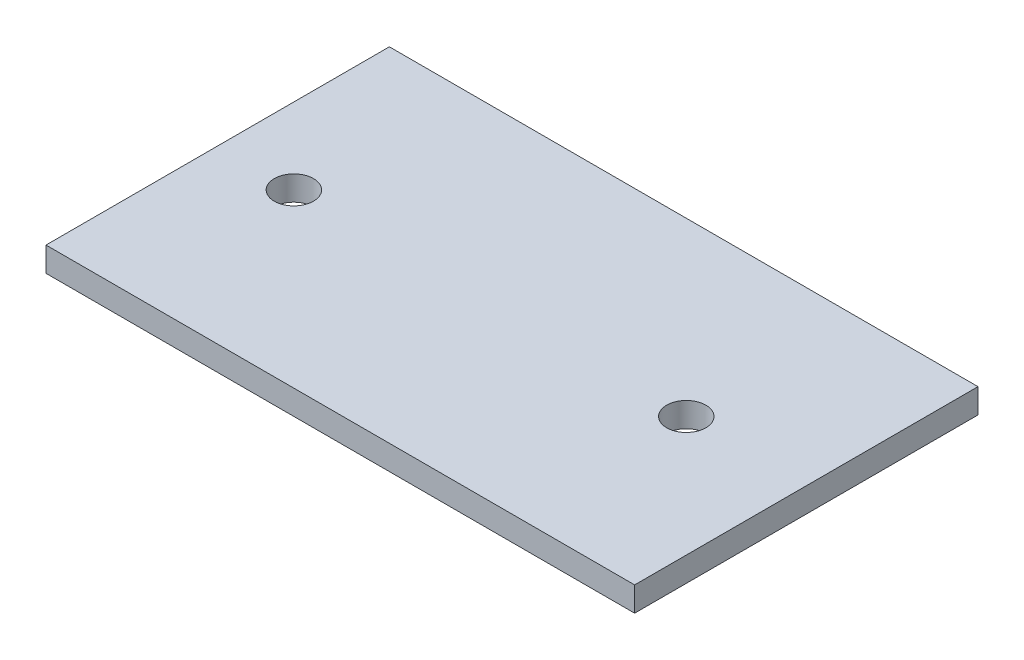
from build123d import *

# Parameters (mm, degrees)
SKETCH1_W           = 120
SKETCH1_H           = 70
SKETCH1_R           = 4
BOSS_EXTRUDE1_DEPTH = 5


with BuildPart() as part:
    # Sketch1 → Boss-Extrude1 (new body)
    with BuildSketch(Plane(origin=(0, 0, 0), x_dir=(1, 0, 0), z_dir=(0, 1, 0))):
        with Locations((44.471360674, -30.034104939)):
            Rectangle(SKETCH1_W, SKETCH1_H)
        with Locations(Location((0, -30.034104939, 0), (0, 0, 270))):
            Circle(SKETCH1_R, mode=Mode.SUBTRACT)
        with Locations(Location((80, -30.034104939, 0), (0, 0, 270))):
            Circle(SKETCH1_R, mode=Mode.SUBTRACT)
    extrude(amount=BOSS_EXTRUDE1_DEPTH)


solid = part.part
